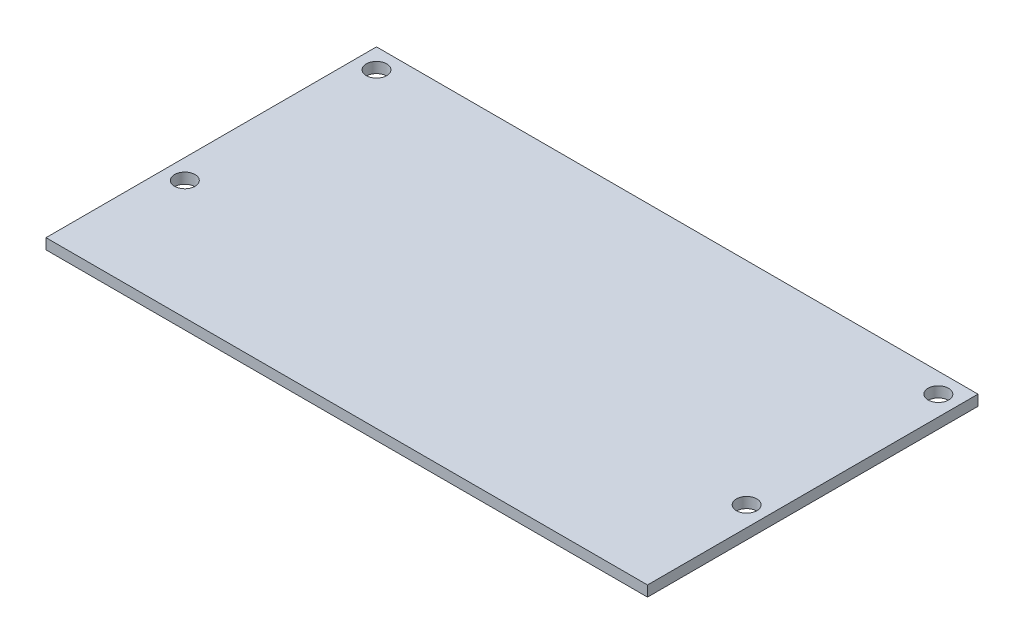
from build123d import *

# Parameters (mm, degrees)
SKETCH_1_W      = 91
SKETCH_1_H      = 50
SKETCH_1_R      = 1.55
EXTRUDE_1_DEPTH = 1.6


with BuildPart() as part:
    # 草图1 → 凸台-拉伸1 (new body)
    with BuildSketch(Plane(origin=(0, 0, 0), x_dir=(1, 0, 0), z_dir=(0, 1, 0))):
        Rectangle(SKETCH_1_W, SKETCH_1_H)
        with Locations(Location((-42.5, -7, 0), (0, 0, 270))):
            Circle(SKETCH_1_R, mode=Mode.SUBTRACT)
        with Locations(Location((-42.5, 22, 0), (0, 0, 270))):
            Circle(SKETCH_1_R, mode=Mode.SUBTRACT)
        with Locations(Location((42.5, 22, 0), (0, 0, 270))):
            Circle(SKETCH_1_R, mode=Mode.SUBTRACT)
        with Locations(Location((42.5, -7, 0), (0, 0, 270))):
            Circle(SKETCH_1_R, mode=Mode.SUBTRACT)
    extrude(amount=EXTRUDE_1_DEPTH)


solid = part.part
